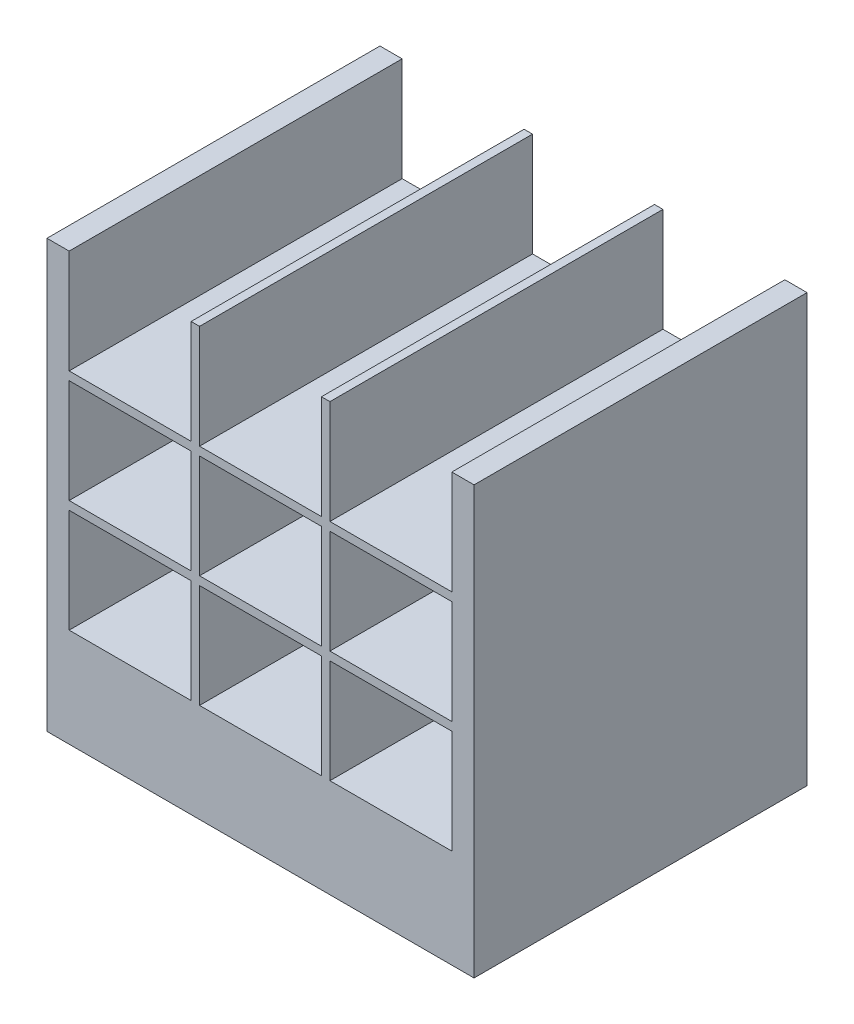
from build123d import *

# Parameters (mm, degrees)
SKETCH1_W           = 137.3
SKETCH1_H           = 9.525
SKETCH1_W_2         = 9.525
SKETCH1_H_2         = 116.877063157
SKETCH1_H_3         = 116.877063158
SKETCH1_W_3         = 480.95
SKETCH1_H_4         = 111.268810527
BOSS_EXTRUDE1_DEPTH = 375


with BuildPart() as part:
    # Sketch1 → Boss-Extrude1 (new body)
    with BuildSketch(Plane.XY):
        Polygon((0, 369.681189473), (0, 0), (25, 0), (25, 116.877063158), (25, 126.402063158), (25, 243.279126316), (25, 252.804126316), (25, 369.681189473), align=None)
        with Locations((93.65, 248.041626316)):
            Rectangle(SKETCH1_W, SKETCH1_H)
        with Locations((167.0625, 248.041626316)):
            Rectangle(SKETCH1_W_2, SKETCH1_H)
        with Locations((167.0625, 311.242657894)):
            Rectangle(SKETCH1_W_2, SKETCH1_H_2)
        with Locations((167.0625, 184.840594737)):
            Rectangle(SKETCH1_W_2, SKETCH1_H_3)
        with Locations((93.65, 121.639563158)):
            Rectangle(SKETCH1_W, SKETCH1_H)
        with Locations((167.0625, 121.639563158)):
            Rectangle(SKETCH1_W_2, SKETCH1_H)
        with Locations((167.0625, 58.438531579)):
            Rectangle(SKETCH1_W_2, SKETCH1_H_3)
        with Locations((240.475, 121.639563158)):
            Rectangle(SKETCH1_W, SKETCH1_H)
        with Locations((240.475, 248.041626316)):
            Rectangle(SKETCH1_W, SKETCH1_H)
        with Locations((313.8875, 311.242657894)):
            Rectangle(SKETCH1_W_2, SKETCH1_H_2)
        with Locations((313.8875, 248.041626316)):
            Rectangle(SKETCH1_W_2, SKETCH1_H)
        with Locations((313.8875, 184.840594737)):
            Rectangle(SKETCH1_W_2, SKETCH1_H_3)
        with Locations((387.3, 248.041626316)):
            Rectangle(SKETCH1_W, SKETCH1_H)
        Polygon((455.95, 0), (480.95, 0), (480.95, 369.681189473), (455.95, 369.681189473), (455.95, 252.804126316), (455.95, 243.279126316), (455.95, 126.402063158), (455.95, 116.877063158), align=None)
        with Locations((387.3, 121.639563158)):
            Rectangle(SKETCH1_W, SKETCH1_H)
        with Locations((313.8875, 121.639563158)):
            Rectangle(SKETCH1_W_2, SKETCH1_H)
        with Locations((313.8875, 58.438531579)):
            Rectangle(SKETCH1_W_2, SKETCH1_H_3)
        with Locations((240.475, -55.634405264)):
            Rectangle(SKETCH1_W_3, SKETCH1_H_4)
    extrude(amount=BOSS_EXTRUDE1_DEPTH)


solid = part.part
